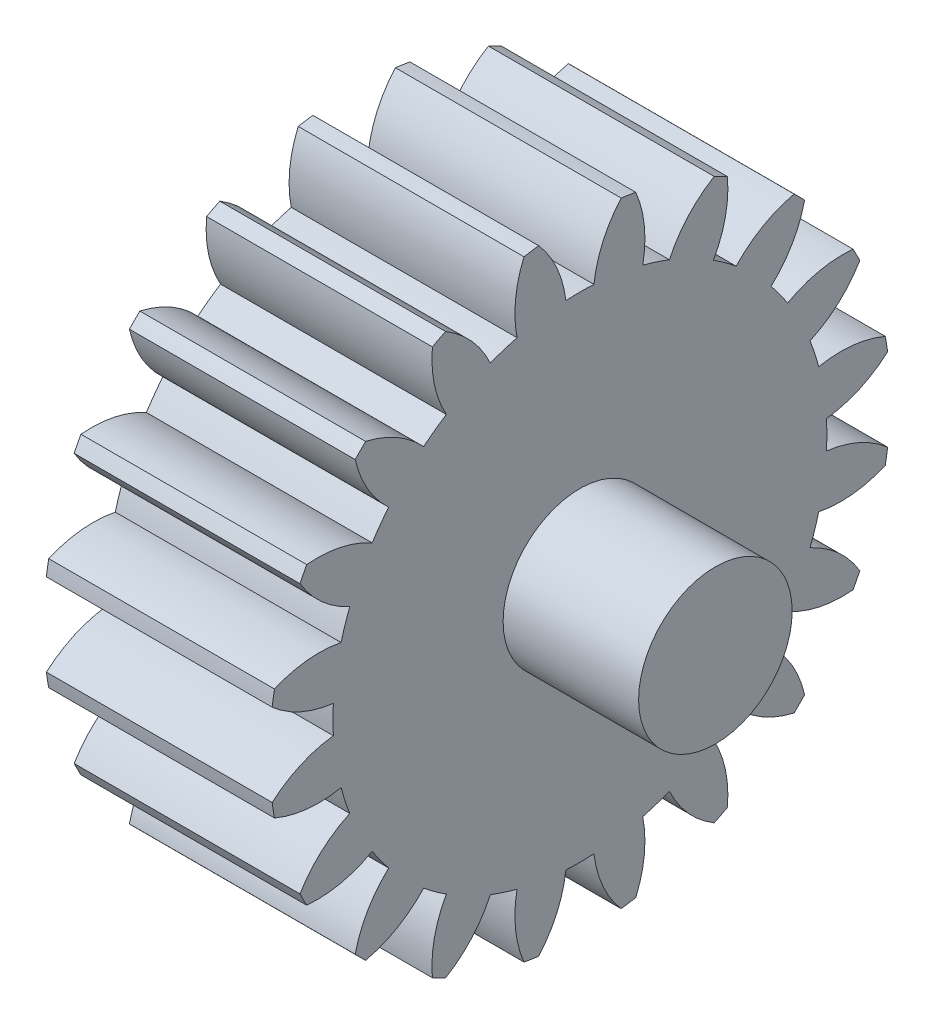
from build123d import *

# Parameters (mm, degrees)
BASPROSKE_W         = 10
BASPROSKE_H         = 13.75
TOOTHCUT_DEPTH      = 22.866069606
TEETHCUTS_COUNT     = 20
TEETHCUTS_ANGLE     = 342
BORSKE_R            = 2
BORE_DEPTH          = 50.0000508
SKETCH2_R           = 2
BOSS_EXTRUDE1_DEPTH = 10
SKETCH3_R           = 3.4
BOSS_EXTRUDE2_DEPTH = 6


with BuildPart() as part:
    # BasProSke → Base-Revolve (revolve)
    with BuildSketch(Plane(origin=(0, 0, 0), x_dir=(1, 0, 0), z_dir=(0, 1, 0)), mode=Mode.PRIVATE) as base_revolve_sk:
        with Locations((5, 6.875)):
            Rectangle(BASPROSKE_W, BASPROSKE_H)
    revolve(base_revolve_sk.sketch.rotate(Axis((-10, 0, 0), (1, 0, 0)), 180), axis=Axis((-10, 0, 0), (1, 0, 0)))

    # TooCutSke → ToothCut (cut, through all)
    with BuildSketch(Plane(origin=(0, 0, 0), x_dir=(0, 0, -1), z_dir=(1, 0, 0))):
        with BuildLine():
            ThreePointArc((0.62110296, 10.918848994), (0, 10.9365), (-0.62110296, 10.918848994))
            ThreePointArc((-0.62110296, 10.918848994), (-1.024517052, 12.378857135), (-1.846615859, 13.651067908))
            ThreePointArc((-1.846615859, 13.651067908), (0, 13.7754), (1.846615859, 13.651067908))
            ThreePointArc((1.846615859, 13.651067908), (1.024517052, 12.378857135), (0.62110296, 10.918848994))
        make_face()
    toothcut = extrude(amount=TOOTHCUT_DEPTH, mode=Mode.SUBTRACT)

    # TeethCuts: ToothCut ×20 about axis
    teethcuts_axis = Axis((-10, 0, 0), (1, 0, 0))
    for i in range(1, TEETHCUTS_COUNT):
        add(toothcut.rotate(teethcuts_axis, i * TEETHCUTS_ANGLE / (TEETHCUTS_COUNT - 1)), mode=Mode.SUBTRACT)

    # BorSke → Bore (cut, symmetric)
    with BuildSketch(Plane(origin=(0, 0, 0), x_dir=(0, 0, -1), z_dir=(1, 0, 0))):
        with Locations(Location((0, 0, 0), (0, 0, 180))):
            Circle(BORSKE_R)
    extrude(amount=BORE_DEPTH, both=True, mode=Mode.SUBTRACT)

    # Sketch2 → Boss-Extrude1 (add)
    with BuildSketch(Plane(origin=(10, 0, 0), x_dir=(0, 0, -1), z_dir=(1, 0, 0))):
        Circle(SKETCH2_R)
    extrude(amount=-BOSS_EXTRUDE1_DEPTH)

    # Sketch3 → Boss-Extrude2 (add)
    with BuildSketch(Plane(origin=(10, 0, 0), x_dir=(0, 0, -1), z_dir=(1, 0, 0))):
        with Locations(Location((0, 0, 0), (0, 0, 180))):
            Circle(SKETCH3_R)
    extrude(amount=BOSS_EXTRUDE2_DEPTH)


solid = part.part
